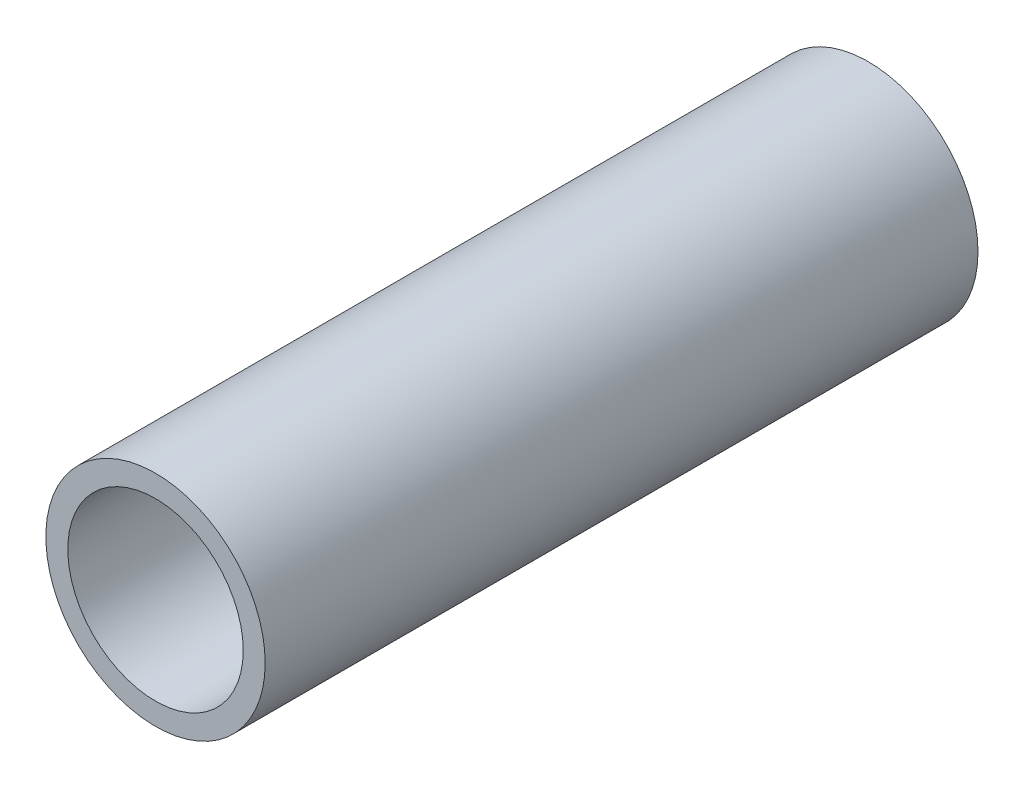
from build123d import *

# Parameters (mm, degrees)
SKETCH_1_R      = 10
SKETCH_1_R_2    = 8
EXTRUDE_1_DEPTH = 65


with BuildPart() as part:
    # 草图1 → 凸台-拉伸1 (new body)
    with BuildSketch(Plane.XY):
        Circle(SKETCH_1_R)
        Circle(SKETCH_1_R_2, mode=Mode.SUBTRACT)
    extrude(amount=EXTRUDE_1_DEPTH)


solid = part.part
